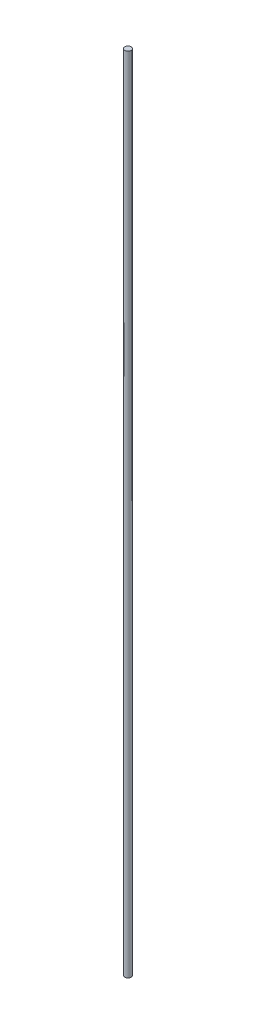
from build123d import *

# Parameters (mm, degrees)
SKETCH1_R           = 4
BOSS_EXTRUDE1_DEPTH = 1010


with BuildPart() as part:
    # Sketch1 → Boss-Extrude1 (new body)
    with BuildSketch(Plane(origin=(0, 0, 0), x_dir=(1, 0, 0), z_dir=(0, 1, 0))):
        with Locations(Location((0, 0, 0), (0, 0, 270))):
            Circle(SKETCH1_R)
    extrude(amount=BOSS_EXTRUDE1_DEPTH)


solid = part.part
